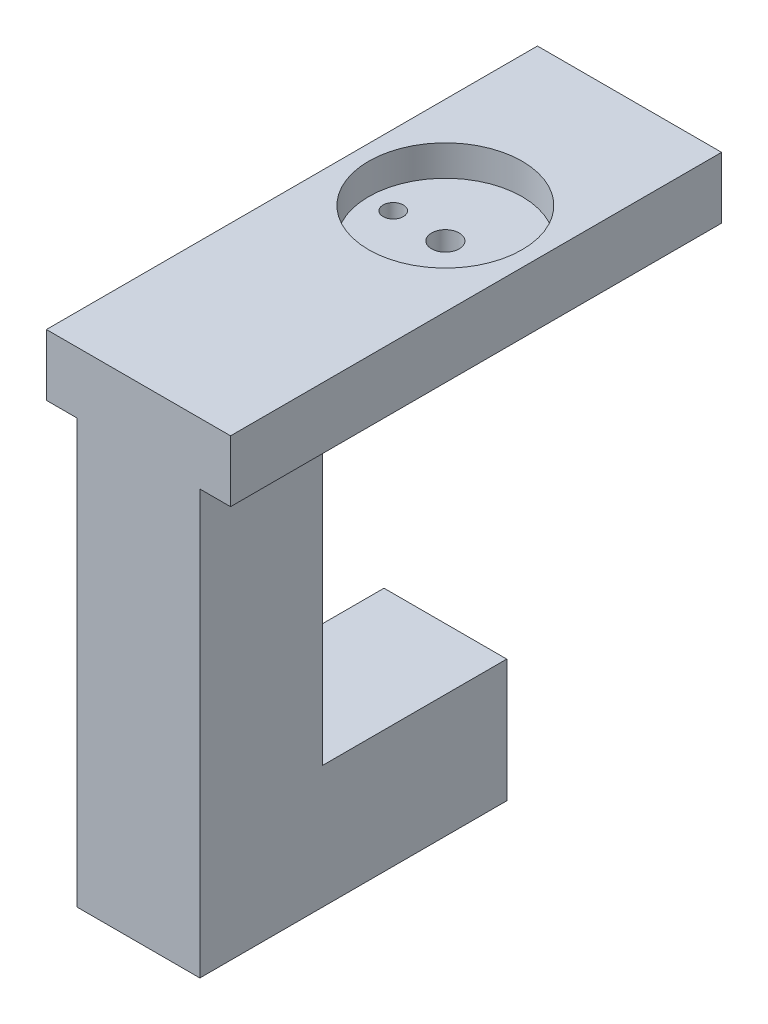
from build123d import *

# Parameters (mm, degrees)
CROQUIS2_W                   = 20
CROQUIS2_H                   = 20
SALIENTE_EXTRUIR1_DEPTH      = 50
CROQUIS3_W                   = 20
CROQUIS3_H                   = 20
SALIENTE_EXTRUIR2_DEPTH      = 59
SALIENTE_EXTRUIR4_DEPTH      = 60
SALIENTE_EXTRUIR4_DEPTH_BACK = 20
CROQUIS7_W                   = 30
CROQUIS7_H                   = 10
CROQUIS14_R                  = 12.5
CORTAR_EXTRUIR4_DEPTH        = 5
CROQUIS16_R                  = 2.25
CORTAR_EXTRUIR5_DEPTH        = 10
CROQUIS19_R                  = 1.65
CORTAR_EXTRUIR6_DEPTH        = 10


with BuildPart() as part:
    # Croquis2 → Saliente-Extruir1 (new body)
    with BuildSketch(Plane.XY):
        Rectangle(CROQUIS2_W, CROQUIS2_H)
    extrude(amount=SALIENTE_EXTRUIR1_DEPTH)

    # Croquis3 → Saliente-Extruir2 (add)
    with BuildSketch(Plane(origin=(0, 10, 0), x_dir=(1, 0, 0), z_dir=(0, 1, 0))):
        with Locations((0, -40)):
            Rectangle(CROQUIS3_W, CROQUIS3_H)
    extrude(amount=SALIENTE_EXTRUIR2_DEPTH)

    # Croquis7 → Saliente-Extruir4 (add, two sides: drawn at the far end of the back side and taken through both)
    with BuildSketch(Plane(origin=(0, 0, 30), x_dir=(-1, 0, 0), z_dir=(0, 0, -1)).offset(-SALIENTE_EXTRUIR4_DEPTH_BACK)):
        with Locations((0, 64)):
            Rectangle(CROQUIS7_W, CROQUIS7_H)
    extrude(amount=SALIENTE_EXTRUIR4_DEPTH + SALIENTE_EXTRUIR4_DEPTH_BACK)

    # Croquis14 → Cortar-Extruir4 (cut)
    with BuildSketch(Plane(origin=(0, 69, 0), x_dir=(1, 0, 0), z_dir=(0, 1, 0))):
        with Locations(Location((0, 0, 0), (0, 0, 270))):
            Circle(CROQUIS14_R)
    extrude(amount=-CORTAR_EXTRUIR4_DEPTH, mode=Mode.SUBTRACT)

    # Croquis16 → Cortar-Extruir5 (cut)
    with BuildSketch(Plane(origin=(0, 64, 0), x_dir=(1, 0, 0), z_dir=(0, 1, 0))):
        with Locations(Location((0, 0, 0), (0, 0, 270))):
            Circle(CROQUIS16_R)
    extrude(amount=-CORTAR_EXTRUIR5_DEPTH, mode=Mode.SUBTRACT)

    # Croquis19 → Cortar-Extruir6 (cut)
    with BuildSketch(Plane(origin=(0, 64, 0), x_dir=(1, 0, 0), z_dir=(0, 1, 0))):
        with Locations(Location((8.5, 0, 0), (0, 0, 270))):
            Circle(CROQUIS19_R)
        with Locations(Location((-8.5, 0, 0), (0, 0, 90))):
            Circle(CROQUIS19_R)
    extrude(amount=-CORTAR_EXTRUIR6_DEPTH, mode=Mode.SUBTRACT)


solid = part.part
